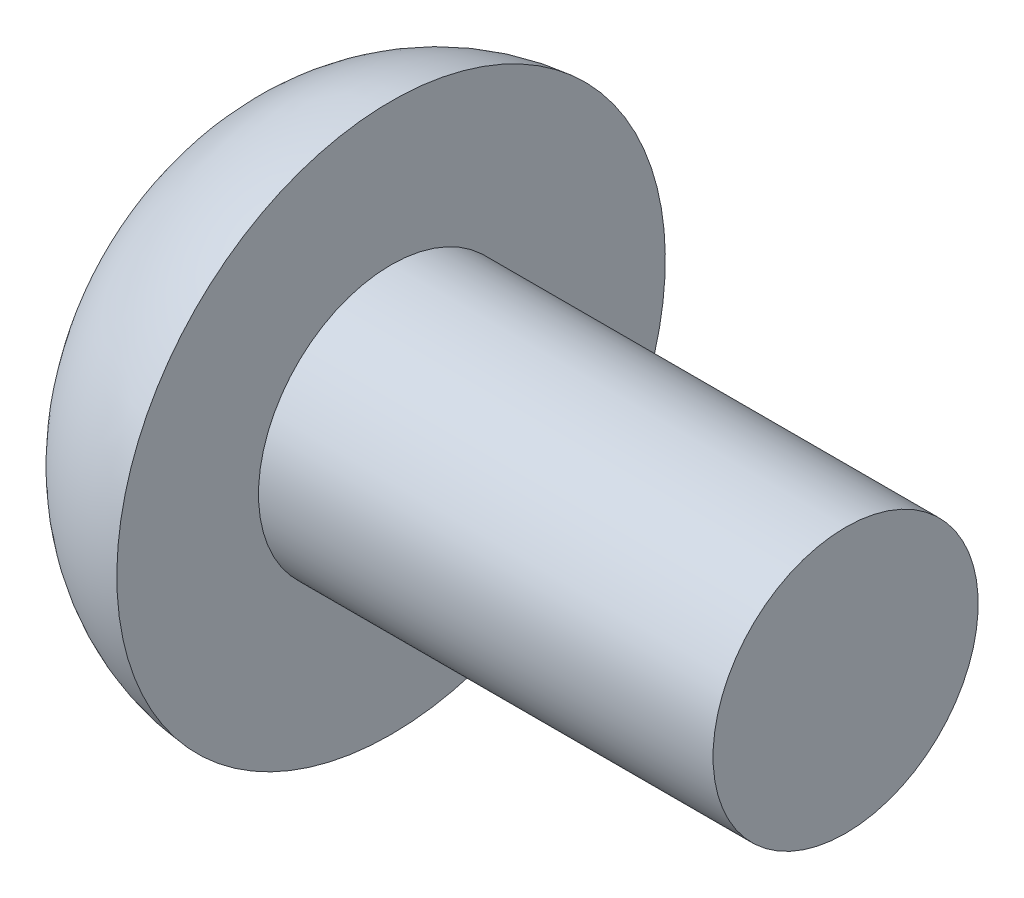
from build123d import *

# Parameters (mm, degrees)
CUT_EXTRUDE_1_DEPTH = 1


with BuildPart() as part:
    # 草图1 → 旋转1 (revolve)
    with BuildSketch(Plane.XY, mode=Mode.PRIVATE) as revolve_1_sk:
        with BuildLine():
            Line((0, 0), (0, 2.2))
            ThreePointArc((0, 2.2), (0.920270994, 3.188453389), (2.2, 3.62))
            Line((2.2, 3.62), (2.2, 1.75))
            Line((2.2, 1.75), (8.2, 1.75))
            Line((8.2, 1.75), (8.2, 0))
            Line((8.2, 0), (0, 0))
        make_face()
    revolve(revolve_1_sk.sketch.rotate(Axis((0, 0, 0), (1, 0, 0)), 180), axis=Axis((0, 0, 0), (1, 0, 0)))

    # 草图2 → 切除-拉伸1 (cut)
    with BuildSketch(Plane.ZY):
        Polygon((0, 1.154700538), (-1, 0.577350269), (-1, -0.577350269), (0, -1.154700538), (1, -0.577350269), (1, 0.577350269), align=None)
    extrude(amount=-CUT_EXTRUDE_1_DEPTH, mode=Mode.SUBTRACT)


solid = part.part
